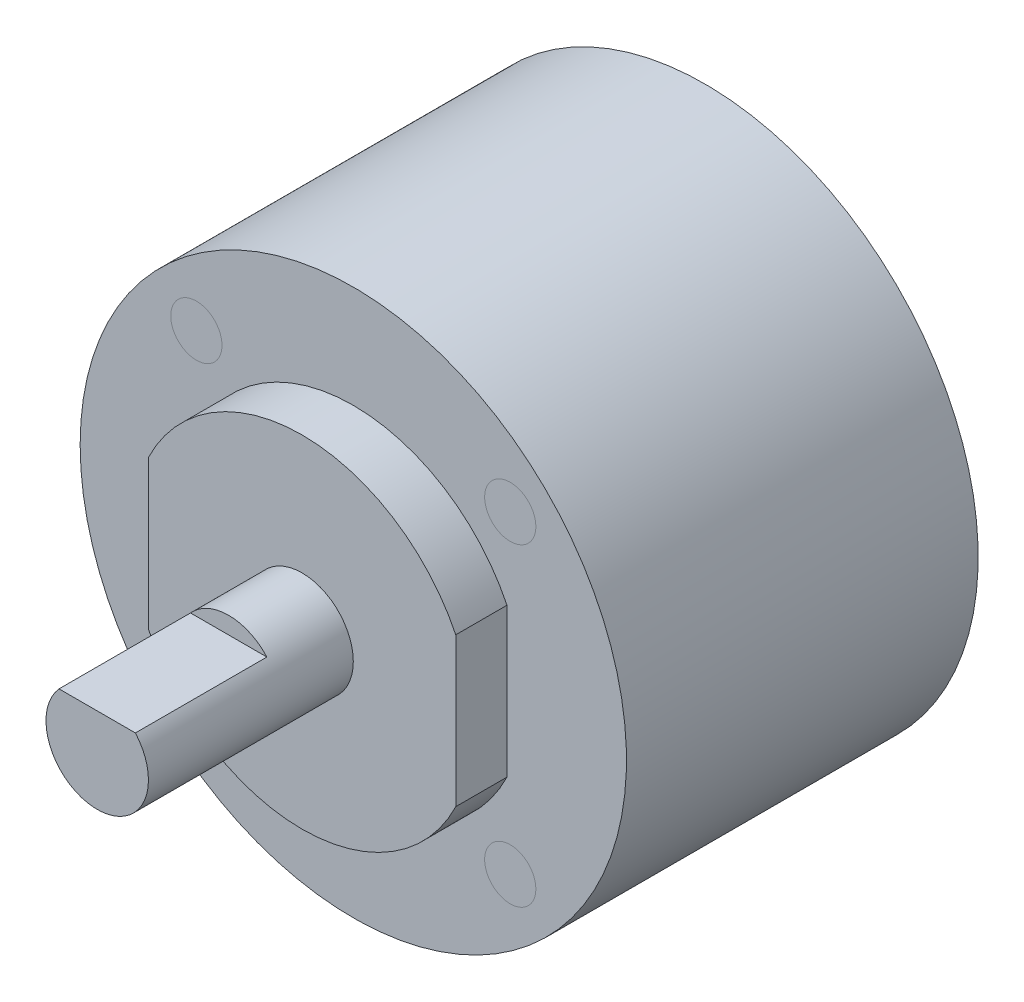
from build123d import *

# Parameters (mm, degrees)
SKETCH_1_R          = 16
EXTRUDE_1_DEPTH     = 20.6
EXTRUDE_2_DEPTH     = 3
SKETCH_3_R          = 3
EXTRUDE_3_DEPTH     = 16.3
CUT_EXTRUDE_START   = -12
CUT_EXTRUDE_1_DEPTH = 12
CUT_EXTRUDE_START_2 = -4.3
SKETCH_7_R          = 3
CUT_EXTRUDE_2_DEPTH = 4.3


with BuildPart() as part:
    # ｽｹｯﾁ1 → ﾎﾞｽ - 押し出し1 (new body)
    with BuildSketch(Plane.XY):
        with Locations(Location((0, 0, 0), (0, 0, 180))):
            Circle(SKETCH_1_R)
    extrude(amount=EXTRUDE_1_DEPTH)

    # ｽｹｯﾁ2 → ﾎﾞｽ - 押し出し2 (add)
    with BuildSketch(Plane.XY.offset(20.6)):
        with BuildLine():
            Line((-9, 4.358898944), (-9, -4.358898944))
            ThreePointArc((-9, -4.358898944), (0, -10), (9, -4.358898944))
            Line((9, -4.358898944), (9, 4.358898944))
            ThreePointArc((9, 4.358898944), (0, 10), (-9, 4.358898944))
        make_face()
    extrude(amount=EXTRUDE_2_DEPTH)

    # ｽｹｯﾁ3 → ﾎﾞｽ - 押し出し3 (add)
    with BuildSketch(Plane.XY.offset(23.6)):
        Circle(SKETCH_3_R)
    extrude(amount=EXTRUDE_3_DEPTH)

    # ｽｹｯﾁ4 → ｶｯﾄ - 押し出し1 (cut)
    with BuildSketch(Plane.XY.offset(39.9).offset(CUT_EXTRUDE_START)):
        with BuildLine():
            Line((-2.236067977, 2), (2.236067977, 2))
            ThreePointArc((2.236067977, 2), (0, 3), (-2.236067977, 2))
        make_face()
    extrude(amount=CUT_EXTRUDE_1_DEPTH, mode=Mode.SUBTRACT)

    # ｽｹｯﾁ7 → ｶｯﾄ - 押し出し2 (cut)
    with BuildSketch(Plane.XY.offset(39.9).offset(CUT_EXTRUDE_START_2)):
        with Locations(Location((0, 0, 0), (0, 0, 138.189685104))):
            Circle(SKETCH_7_R)
    extrude(amount=CUT_EXTRUDE_2_DEPTH, mode=Mode.SUBTRACT)


solid = part.part
